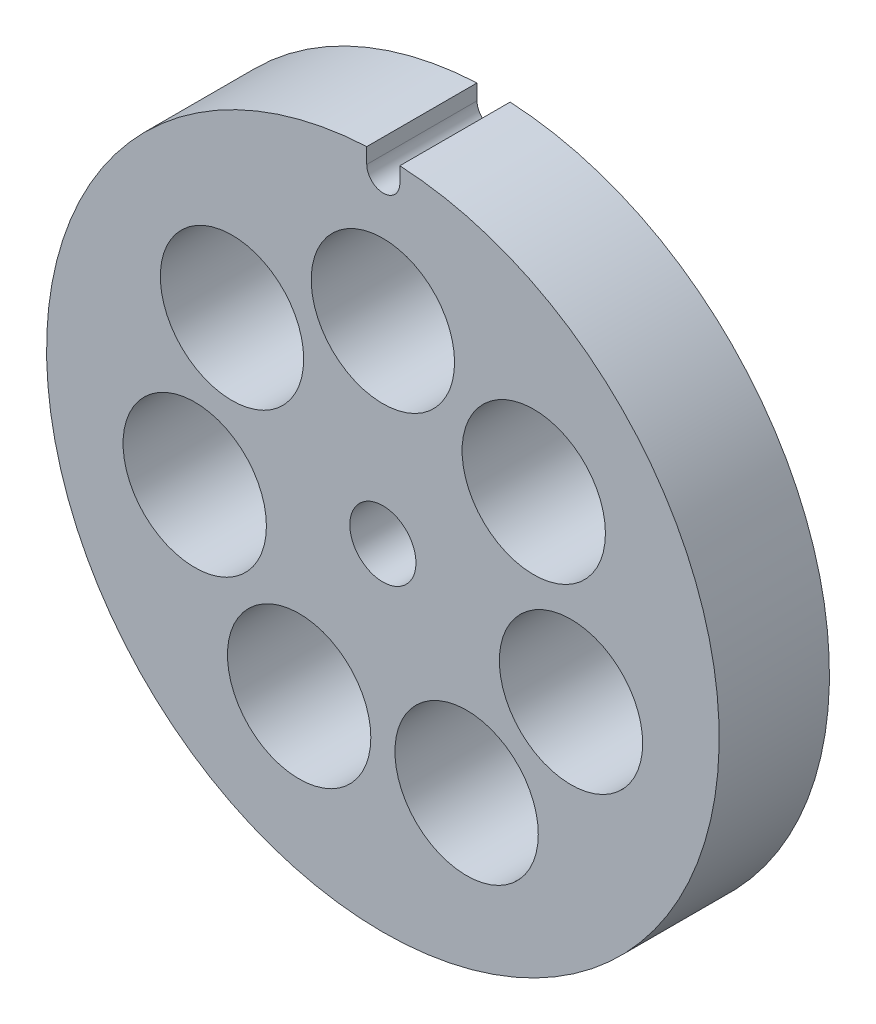
from build123d import *

# Parameters (mm, degrees)
SZKIC1_R                    = 6.5
SZKIC1_R_2                  = 3
DODANIE_WYCI_GNI_CIE1_DEPTH = 10


with BuildPart() as part:
    # Szkic1 → Dodanie-wyciągnięcie1 (new body)
    with BuildSketch(Plane.XY):
        with BuildLine():
            ThreePointArc((1.536461967, 29.061275164), (0.036461967, 27.561275164), (-1.463538033, 29.061275164))
            Line((-1.463538033, 29.061275164), (-1.463538033, 30.464865935))
            ThreePointArc((-1.463538033, 30.464865935), (-21.042957135, -22.07813296), (30.5, 0))
            ThreePointArc((30.5, 0), (22.103303938, 21.016516243), (1.536461967, 30.461275164))
            Line((1.536461967, 30.461275164), (1.536461967, 29.061275164))
        make_face()
        with Locations((-7.592965435, -15.766955188)):
            Circle(SZKIC1_R, mode=Mode.SUBTRACT)
        with Locations((-17.061238463, -3.894116344)):
            Circle(SZKIC1_R, mode=Mode.SUBTRACT)
        with Locations((7.592965435, -15.766955188)):
            Circle(SZKIC1_R, mode=Mode.SUBTRACT)
        with Locations((17.061238463, -3.894116344)):
            Circle(SZKIC1_R, mode=Mode.SUBTRACT)
        with Locations((-13.682050943, 10.911071533)):
            Circle(SZKIC1_R, mode=Mode.SUBTRACT)
        Circle(SZKIC1_R_2, mode=Mode.SUBTRACT)
        with Locations((13.682050943, 10.911071533)):
            Circle(SZKIC1_R, mode=Mode.SUBTRACT)
        with Locations((0, 17.5)):
            Circle(SZKIC1_R, mode=Mode.SUBTRACT)
    extrude(amount=DODANIE_WYCI_GNI_CIE1_DEPTH)


solid = part.part
